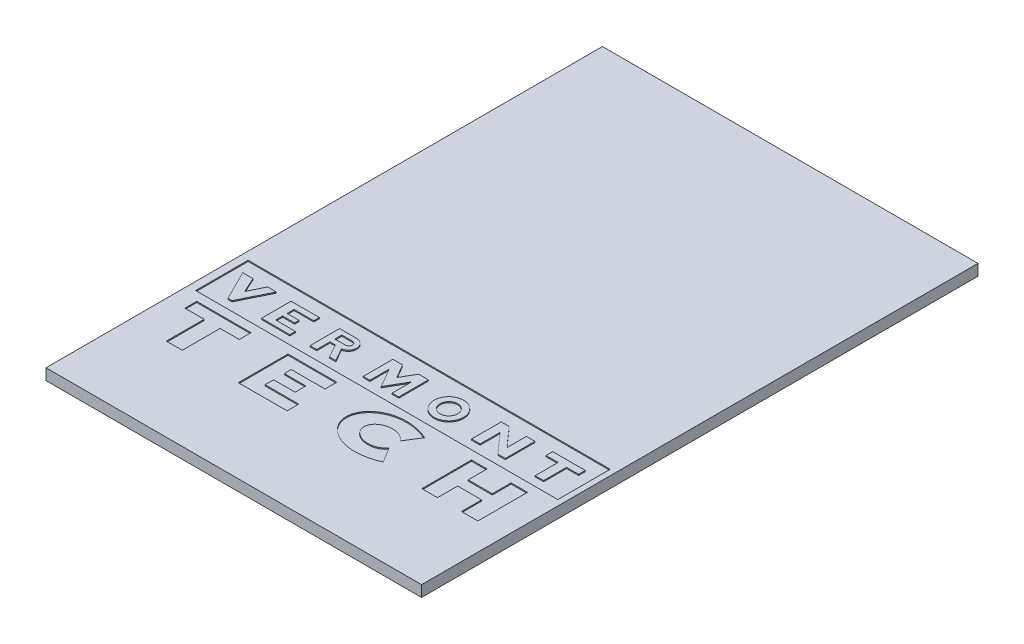
from build123d import *

# Parameters (mm, degrees)
SKETCH2_W           = 85.725
SKETCH2_H           = 127
BOSS_EXTRUDE2_DEPTH = 2.54
SKETCH25_W          = 82.644974211
SKETCH25_H          = 11.973738266
SKETCH25_R          = 3.375228747
SKETCH25_R_2        = 2.016253288
CUT_EXTRUDE3_DEPTH  = 0.254


with BuildPart() as part:
    # Sketch2 → Boss-Extrude2 (new body)
    with BuildSketch(Plane(origin=(0, 0, 0), x_dir=(1, 0, 0), z_dir=(0, 1, 0))):
        Rectangle(SKETCH2_W, SKETCH2_H)
    extrude(amount=-BOSS_EXTRUDE2_DEPTH)

    # Sketch25 → Cut-Extrude3 (cut)
    # profile 1 of 7: a face of its own
    with BuildSketch(Plane(origin=(0, 0, 0), x_dir=(1, 0, 0), z_dir=(0, 1, 0))):
        Polygon((-26.401346176, -35.854393253), (-26.401346176, -33.15882687), (-38.799482128, -33.15882687), (-38.799482128, -35.854393253), (-34.402699091, -35.854393253), (-34.402699091, -44.489516695), (-30.772866408, -44.489516695), (-30.772866408, -35.854393253), align=None)
    # profile 2 of 7: a face of its own
    with BuildSketch(Plane(origin=(0, 0, 0), x_dir=(1, 0, 0), z_dir=(0, 1, 0))):
        with Locations((0.269409109, -25.156846289)):
            Rectangle(SKETCH25_W, SKETCH25_H)
        Polygon((-36.860699174, -22.244332024), (-35.276491705, -25.743290865), (-33.551494351, -22.244332024), (-31.583895256, -22.244332024), (-34.91189134, -28.994789518), (-35.827566034, -28.994789518), (-39.202300363, -22.244332024), align=None, mode=Mode.SUBTRACT)
        Polygon((-21.586075079, -29.121583639), (-28.052993946, -29.121583639), (-28.052993946, -22.371126145), (-21.61112205, -22.371126145), (-21.61112205, -23.638154892), (-26.091406212, -23.638154892), (-26.091406212, -25.238354892), (-23.369701588, -25.238354892), (-23.369701588, -26.254354892), (-26.093979632, -26.254354892), (-26.093979632, -27.854554892), (-21.586075079, -27.854554892), align=None, mode=Mode.SUBTRACT)
        with BuildLine():
            Line((-12.886623389, -26.048756675), (-11.21689897, -28.994789518))
            Line((-11.21689897, -28.994789518), (-12.646380862, -28.994789518))
            Line((-12.646380862, -28.994789518), (-14.370072898, -25.953537147))
            Line((-14.370072898, -25.953537147), (-15.588703764, -25.953537147))
            Line((-15.588703764, -25.953537147), (-15.588703764, -28.994789518))
            Line((-15.588703764, -28.994789518), (-17.109275161, -28.994789518))
            Line((-17.109275161, -28.994789518), (-17.109275161, -22.244332024))
            Line((-17.109275161, -22.244332024), (-13.19566722, -22.244332024))
            ThreePointArc((-13.19566722, -22.244332024), (-11.287189095, -24.004065684), (-12.886623389, -26.048756675))
        make_face(mode=Mode.SUBTRACT)
        Polygon((-4.961504317, -22.244332024), (-2.717782968, -22.244332024), (-0.899784822, -25.393197181), (0.918213323, -22.244332024), (3.161934673, -22.244332024), (3.161934673, -28.994789518), (1.638789862, -28.994789518), (1.638789862, -24.566513755), (-0.899784822, -28.963454088), (-3.438359507, -24.566513755), (-3.438359507, -28.994789518), (-4.961504317, -28.994789518), align=None, mode=Mode.SUBTRACT)
        with Locations(Location((11.211495581, -25.619560771, 0), (0, 0, 270))):
            Circle(SKETCH25_R, mode=Mode.SUBTRACT)
        Polygon((19.780384204, -22.244332024), (21.610158793, -22.244332024), (25.523367769, -26.689139429), (25.523367769, -22.244332024), (27.473297536, -22.244332024), (27.473297536, -28.994789518), (25.748580132, -28.994789518), (21.73031397, -24.430653204), (21.73031397, -28.994789518), (19.780384204, -28.994789518), align=None, mode=Mode.SUBTRACT)
        Polygon((34.286281548, -23.770960204), (31.532751091, -23.770960204), (31.532751091, -22.244332024), (38.967725504, -22.244332024), (38.967725504, -23.770960204), (36.214195047, -23.770960204), (36.214195047, -28.994789518), (34.286281548, -28.994789518), align=None, mode=Mode.SUBTRACT)
    # profile 3 of 7: a face of its own
    with BuildSketch(Plane(origin=(0, 0, 0), x_dir=(1, 0, 0), z_dir=(0, 1, 0))):
        Polygon((-14.518148777, -37.438819572), (-14.518148777, -35.854393253), (-6.83027872, -35.854393253), (-6.83027872, -33.15882687), (-17.964276023, -33.15882687), (-17.964276023, -44.489516695), (-6.833681126, -44.489516695), (-6.833681126, -41.83560261), (-14.518148777, -41.83560261), (-14.518148777, -39.894680368), (-9.606427186, -39.894680368), (-9.606427186, -37.438819572), align=None)
    # profile 4 of 7: a face of its own
    with BuildSketch(Plane(origin=(0, 0, 0), x_dir=(1, 0, 0), z_dir=(0, 1, 0))):
        with BuildLine():
            ThreePointArc((-13.19566722, -24.851050278), (-12.39556722, -24.050950278), (-13.19566722, -23.250850278))
            Line((-13.19566722, -23.250850278), (-15.588703764, -23.250850278))
            Line((-15.588703764, -23.250850278), (-15.588703764, -24.851050278))
            Line((-15.588703764, -24.851050278), (-13.19566722, -24.851050278))
        make_face()
    # profile 5 of 7: a face of its own
    with BuildSketch(Plane(origin=(0, 0, 0), x_dir=(1, 0, 0), z_dir=(0, 1, 0))):
        Polygon((23.921491499, -33.15882687), (23.921491499, -44.489516695), (27.49217728, -44.489516695), (27.49217728, -39.894680368), (32.958681558, -39.894680368), (32.958681558, -44.489516695), (36.700300901, -44.489516695), (36.700300901, -33.15882687), (32.958681558, -33.15882687), (32.958681558, -37.463958465), (27.469552399, -37.463958465), (27.469552399, -33.15882687), align=None)
    # profile 6 of 7: a face of its own
    with BuildSketch(Plane(origin=(0, 0, 0), x_dir=(1, 0, 0), z_dir=(0, 1, 0))):
        with BuildLine():
            add(Edge.make_bspline(
                [(12.034728003, -37.513702885), (9.837658355, -34.446600836), (6.369591885, -36.687217957), (2.901525415, -38.927835078), (6.485301367, -41.099026419), (10.069077319, -43.270217761), (12.104171052, -40.161449829)],
                knots=[3.655446415, 3.655446415, 3.655446415, 5.427524106, 5.427524106, 7.199601796, 7.199601796, 8.971679487, 8.971679487, 8.971679487], degree=2, weights=[1, 0.632485182, 1, 0.632485182, 1, 0.632485182, 1]))
            Line((12.034728003, -37.513702885), (14.159680346, -34.137428518))
            add(Edge.make_bspline(
                [(14.159680346, -34.137428518), (11.789724765, -32.931705874), (8.818474178, -32.911735742)],
                knots=[4.069421787, 4.069421787, 4.069421787, 4.71238898, 4.71238898, 4.71238898], degree=2, weights=[1, 0.948767684, 1]))
            add(Edge.make_bspline(
                [(8.818474178, -32.911735742), (1.080845291, -32.85973021), (1.04079924, -38.817971113), (1.000753188, -44.776212016), (8.738382074, -44.828217548)],
                knots=[4.71238898, 4.71238898, 4.71238898, 6.283185307, 6.283185307, 7.853981634, 7.853981634, 7.853981634], degree=2, weights=[1, 0.707106781, 1, 0.707106781, 1]))
            add(Edge.make_bspline(
                [(8.738382074, -44.828217548), (11.812086243, -44.848876282), (14.24204363, -43.600803586)],
                knots=[1.570796327, 1.570796327, 1.570796327, 2.234366112, 2.234366112, 2.234366112], degree=2, weights=[1, 0.945462455, 1]))
            Line((14.24204363, -43.600803586), (12.104171052, -40.161449829))
        make_face()
    # profile 7 of 7: a face of its own
    with BuildSketch(Plane(origin=(0, 0, 0), x_dir=(1, 0, 0), z_dir=(0, 1, 0))):
        with Locations(Location((11.211495581, -25.619560771, 0), (0, 0, 270))):
            Circle(SKETCH25_R_2)
    extrude(amount=-CUT_EXTRUDE3_DEPTH, mode=Mode.SUBTRACT)


solid = part.part
